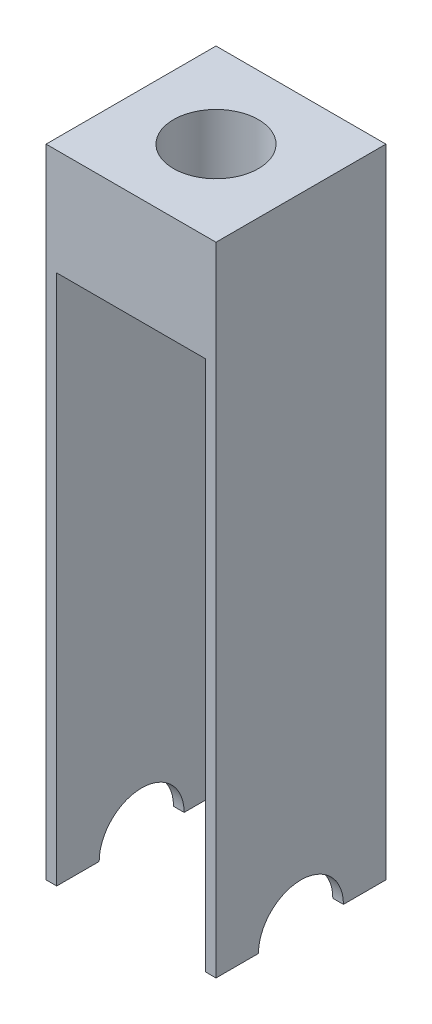
from build123d import *

# Parameters (mm, degrees)
BOSS_EXTRUDE1_DEPTH = 80
SKETCH3_W           = 70
SKETCH3_H           = 250
CUT_EXTRUDE1_DEPTH  = 188.882942281
SKETCH4_R           = 20
CUT_EXTRUDE2_DEPTH  = 40


with BuildPart() as part:
    # Sketch2 → Boss-Extrude1 (new body)
    with BuildSketch(Plane(origin=(0, 0, 0), x_dir=(0, 0, -1), z_dir=(1, 0, 0))):
        with BuildLine():
            Line((-20, -150), (-40, -150))
            Line((-40, -150), (-40, 150))
            Line((-40, 150), (40, 150))
            Line((40, 150), (40, -150))
            Line((40, -150), (20, -150))
            ThreePointArc((20, -150), (0, -130), (-20, -150))
        make_face()
    extrude(amount=BOSS_EXTRUDE1_DEPTH)

    # Sketch3 → Cut-Extrude1 (cut, through all)
    with BuildSketch(Plane.XY.offset(40)):
        with Locations((40, -25)):
            Rectangle(SKETCH3_W, SKETCH3_H)
    extrude(amount=-CUT_EXTRUDE1_DEPTH, mode=Mode.SUBTRACT)

    # Sketch4 → Cut-Extrude2 (cut)
    with BuildSketch(Plane(origin=(0, 150, 0), x_dir=(1, 0, 0), z_dir=(0, 1, 0))):
        with Locations(Location((40, 0, 0), (0, 0, 270))):
            Circle(SKETCH4_R)
    extrude(amount=-CUT_EXTRUDE2_DEPTH, mode=Mode.SUBTRACT)


solid = part.part
